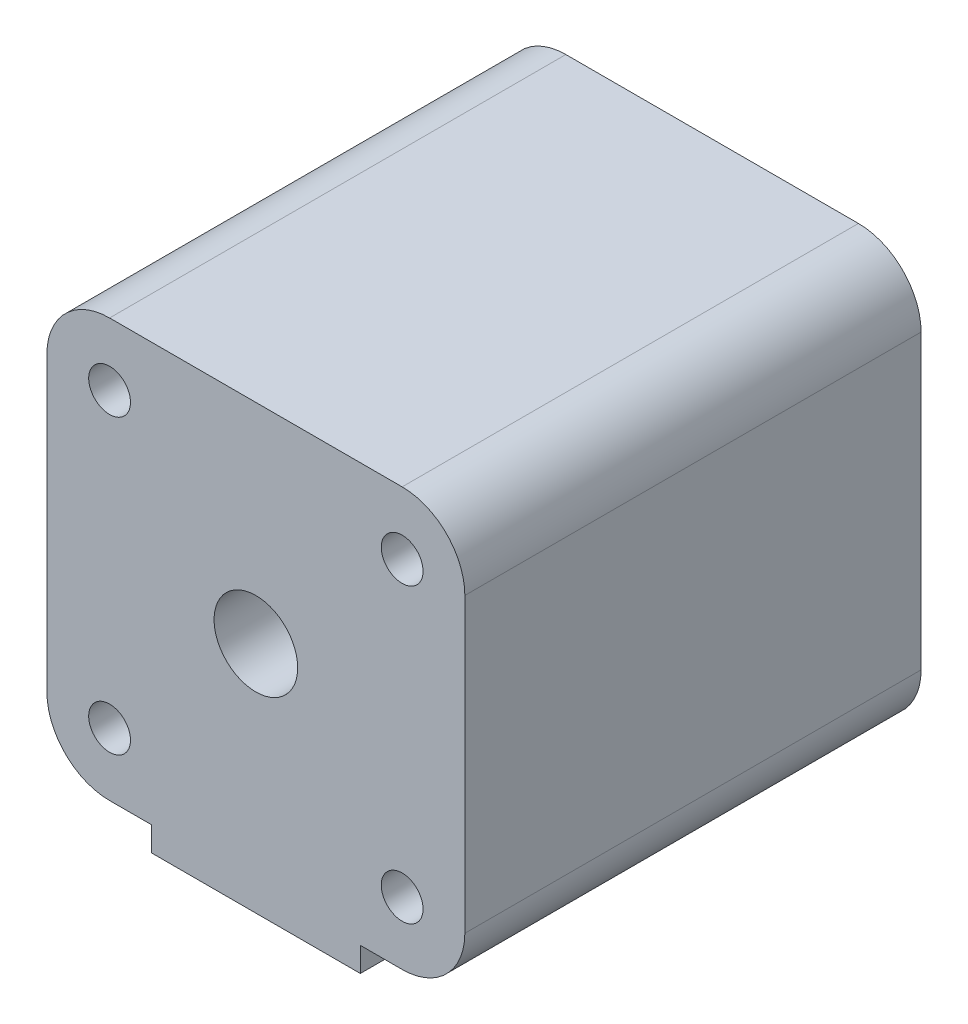
from build123d import *

# Parameters (mm, degrees)
SALIENTE_EXTRUIR1_DEPTH = 65.5
CROQUIS2_R              = 3
CORTAR_EXTRUIR1_DEPTH   = 20
CROQUIS3_R              = 6
CORTAR_EXTRUIR2_DEPTH   = 20
CROQUIS4_R              = 4.5
CORTAR_EXTRUIR3_DEPTH   = 6


with BuildPart() as part:
    # Croquis1 → Saliente-Extruir1 (new body)
    with BuildSketch(Plane.XY):
        with BuildLine():
            Line((-15, -30), (-15, -33.5))
            Line((-15, -33.5), (15, -33.5))
            Line((15, -33.5), (15, -30))
            Line((15, -30), (21, -30))
            ThreePointArc((21, -30), (27.363961031, -27.363961031), (30, -21))
            Line((30, -21), (30, 21))
            ThreePointArc((30, 21), (27.363961031, 27.363961031), (21, 30))
            Line((21, 30), (-21, 30))
            ThreePointArc((-21, 30), (-27.363961031, 27.363961031), (-30, 21))
            Line((-30, 21), (-30, -21))
            ThreePointArc((-30, -21), (-27.363961031, -27.363961031), (-21, -30))
            Line((-21, -30), (-15, -30))
        make_face()
    extrude(amount=-SALIENTE_EXTRUIR1_DEPTH)

    # Croquis2 → Cortar-Extruir1 (cut)
    with BuildSketch(Plane.XY):
        with Locations((-21, 21)):
            Circle(CROQUIS2_R)
        with Locations((21, 21)):
            Circle(CROQUIS2_R)
        with Locations((21, -21)):
            Circle(CROQUIS2_R)
        with Locations((-21, -21)):
            Circle(CROQUIS2_R)
    extrude(amount=-CORTAR_EXTRUIR1_DEPTH, mode=Mode.SUBTRACT)

    # Croquis3 → Cortar-Extruir2 (cut)
    with BuildSketch(Plane.XY):
        Circle(CROQUIS3_R)
    extrude(amount=-CORTAR_EXTRUIR2_DEPTH, mode=Mode.SUBTRACT)

    # Croquis4 → Cortar-Extruir3 (cut)
    with BuildSketch(Plane.XZ.offset(33.5)):
        with Locations(Location((0, -5.5, 0), (0, 0, 270))):
            Circle(CROQUIS4_R)
        with Locations(Location((0, -60, 0), (0, 0, 270))):
            Circle(CROQUIS4_R)
    extrude(amount=-CORTAR_EXTRUIR3_DEPTH, mode=Mode.SUBTRACT)


solid = part.part
